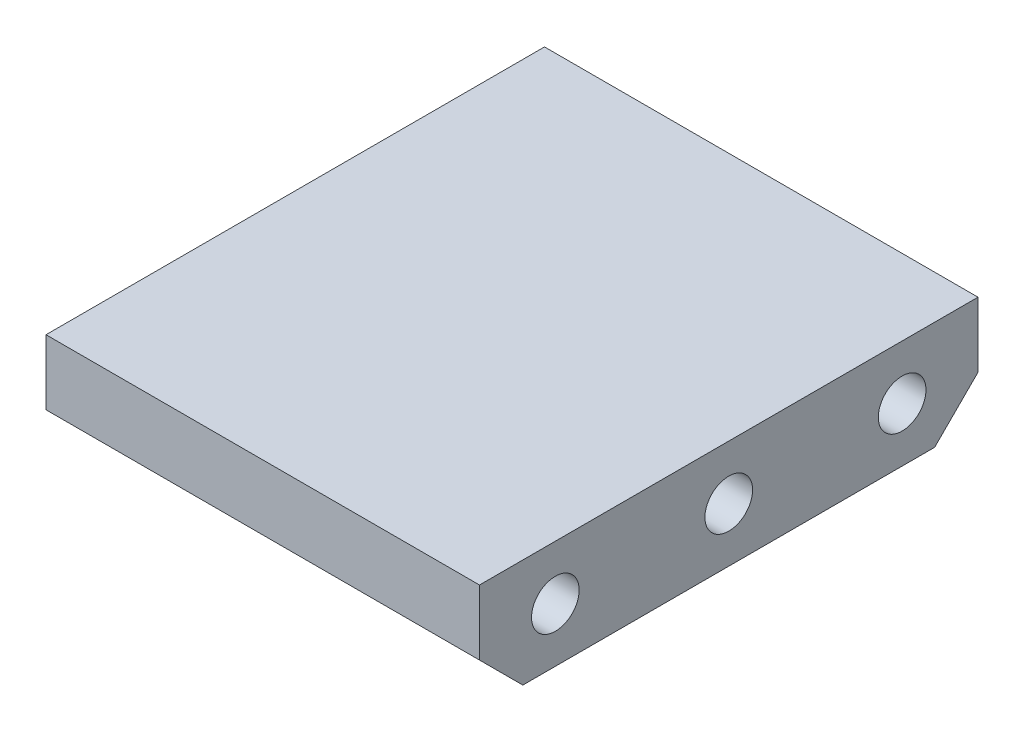
from build123d import *

# Parameters (mm, degrees)
SKIZZE1_R                       = 11
AUFSATZ_LINEAR_AUSTRAGEN1_DEPTH = 100


with BuildPart() as part:
    # Skizze1 → Aufsatz-Linear austragen1 (new, symmetric)
    with BuildSketch(Plane(origin=(0, 0, 0), x_dir=(0, 0, -1), z_dir=(1, 0, 0))):
        Polygon((-115, 0), (115, 0), (115, -30), (95, -50), (-95, -50), (-115, -30), align=None)
        with Locations((0, -25)):
            Circle(SKIZZE1_R, mode=Mode.SUBTRACT)
        with Locations((-80, -25)):
            Circle(SKIZZE1_R, mode=Mode.SUBTRACT)
        with Locations(Location((80, -25, 0), (0, 0, 180))):
            Circle(SKIZZE1_R, mode=Mode.SUBTRACT)
    extrude(amount=AUFSATZ_LINEAR_AUSTRAGEN1_DEPTH, both=True)


solid = part.part
